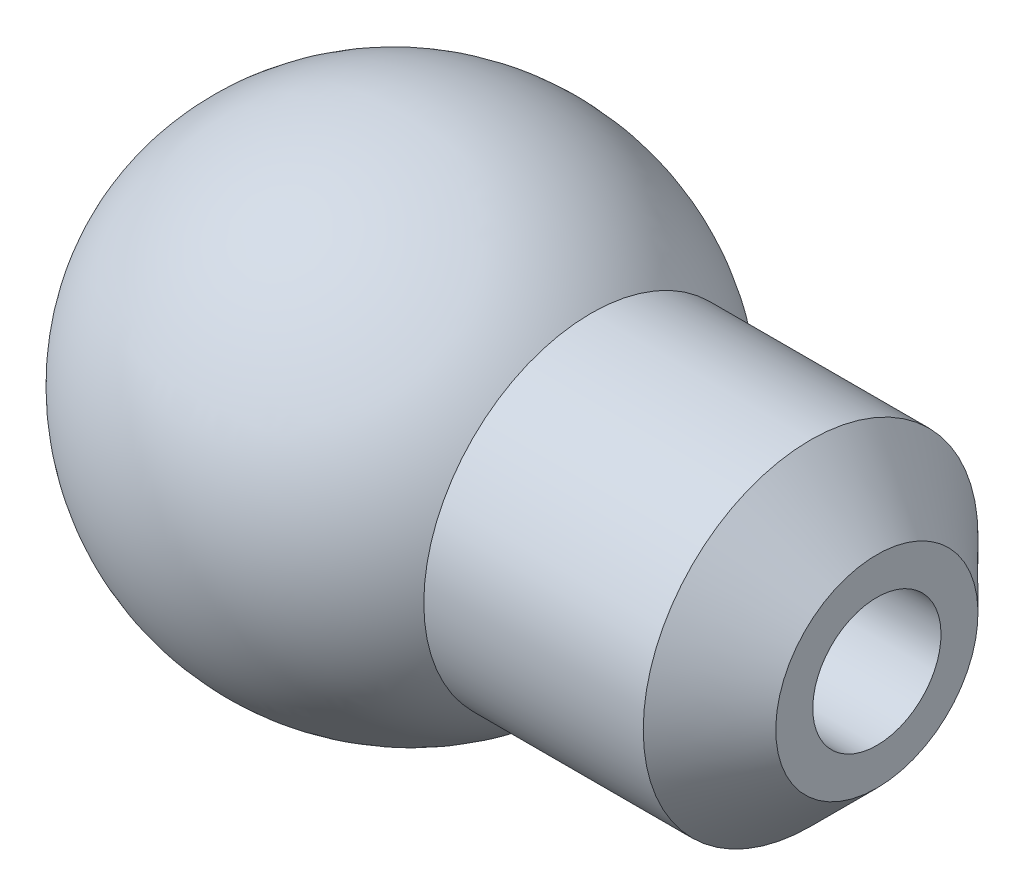
from build123d import *


with BuildPart() as part:
    # Sketch1 → Revolve2 (revolve)
    with BuildSketch(Plane.XY, mode=Mode.PRIVATE) as revolve2_sk:
        with BuildLine():
            Line((0, 26), (60, 26))
            Line((60, 26), (60, 41))
            Line((60, 41), (33.129942315, 67.870057685))
            Line((33.129942315, 67.870057685), (-55.848694146, 67.870057685))
            ThreePointArc((-55.848694146, 67.870057685), (-169.745554571, 93.142343424), (-240, 0))
            Line((-240, 0), (0, 0))
            Line((0, 0), (0, 26))
        make_face()
    revolve(revolve2_sk.sketch.rotate(Axis((-240, 0, 0), (1, 0, 0)), 180), axis=Axis((-240, 0, 0), (1, 0, 0)))


solid = part.part
